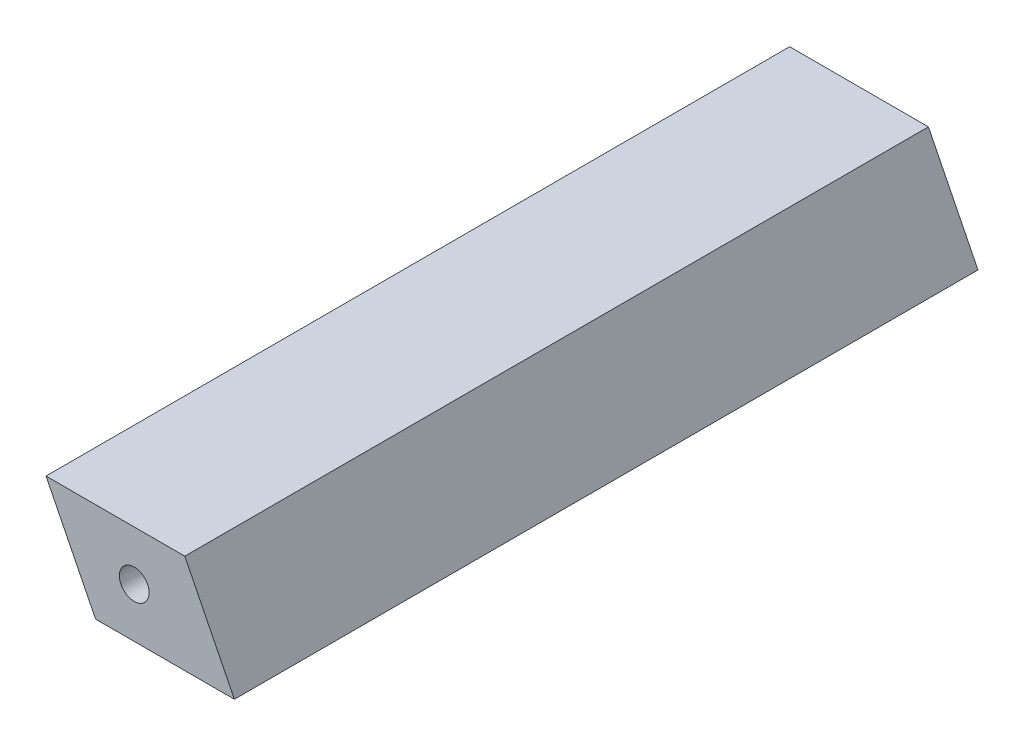
from build123d import *

# Parameters (mm, degrees)
BOSS_EXTRUDE1_DEPTH = 38.1
SKETCH2_R           = 0.762
CUT_EXTRUDE1_DEPTH  = 7.62
CUT_EXTRUDE2_START  = -7.62
SKETCH3_R           = 0.762
CUT_EXTRUDE2_DEPTH  = 7.62


with BuildPart() as part:
    # Sketch1 → Boss-Extrude1 (new body)
    with BuildSketch(Plane.XY):
        Polygon((0, 0), (7.112, 0), (4.571451506, 5.08), (-2.540548494, 5.08), align=None)
    extrude(amount=-BOSS_EXTRUDE1_DEPTH)

    # Sketch2 → Cut-Extrude1 (cut)
    with BuildSketch(Plane.XY):
        with Locations((1.979121083, 2.54)):
            Circle(SKETCH2_R)
    extrude(amount=-CUT_EXTRUDE1_DEPTH, mode=Mode.SUBTRACT)

    # Sketch3 → Cut-Extrude2 (cut)
    with BuildSketch(Plane(origin=(0, 0, -38.1), x_dir=(-1, 0, 0), z_dir=(0, 0, -1)).offset(CUT_EXTRUDE2_START)):
        with Locations(Location((-1.979121083, 2.54, 0), (0, 0, 180))):
            Circle(SKETCH3_R)
    extrude(amount=CUT_EXTRUDE2_DEPTH, mode=Mode.SUBTRACT)


solid = part.part
